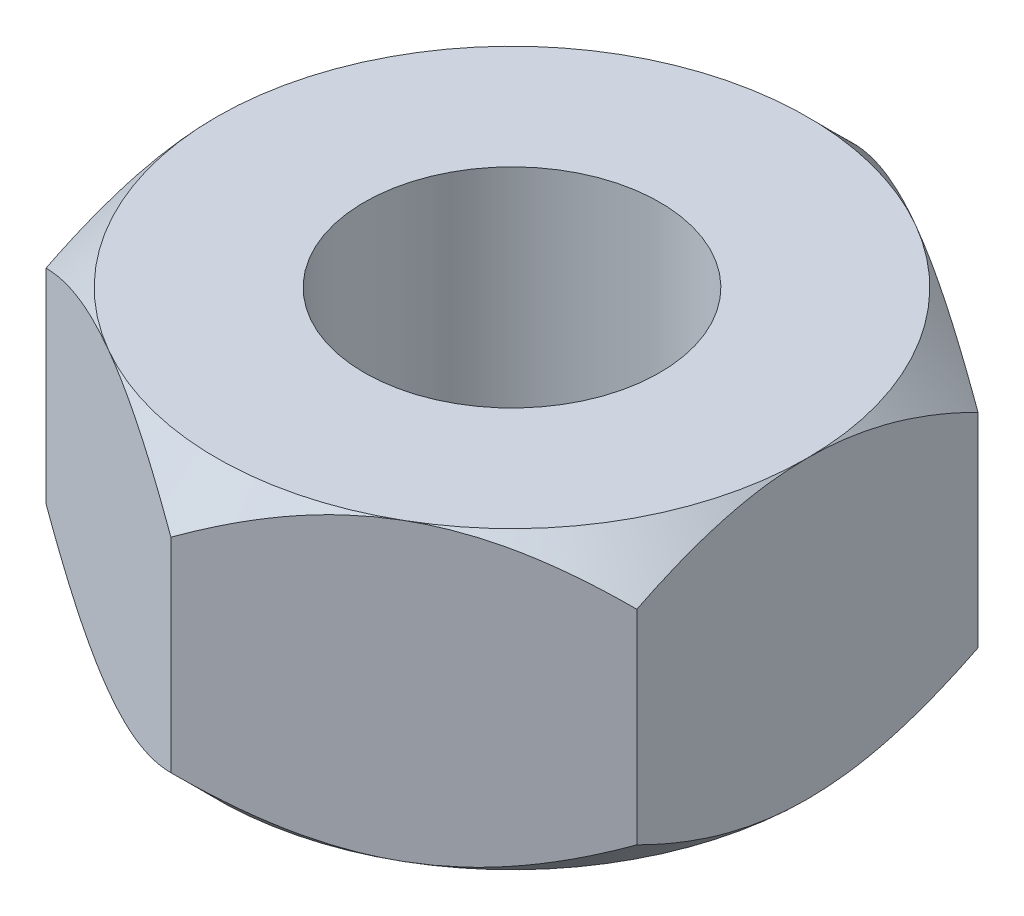
from build123d import *

# Parameters (mm, degrees)
SKETCH1_R           = 1.5
BOSS_EXTRUDE1_DEPTH = 1.5


with BuildPart() as part:
    # Sketch1 → Boss-Extrude1 (new, symmetric)
    with BuildSketch(Plane(origin=(0, 0, 0), x_dir=(1, 0, 0), z_dir=(0, 1, 0))):
        Polygon((0, 3.464101615), (-3, 1.732050808), (-3, -1.732050808), (0, -3.464101615), (3, -1.732050808), (3, 1.732050808), align=None)
        with Locations(Location((0, 0, 0), (0, 0, 270))):
            Circle(SKETCH1_R, mode=Mode.SUBTRACT)
    extrude(amount=BOSS_EXTRUDE1_DEPTH, both=True)

    # Cut-Sweep1: sweep along a path in Sketch2
    with BuildLine(Plane(origin=(0, 1.5, 0), x_dir=(1, 0, 0), z_dir=(0, 1, 0))) as cut_sweep1_path:
        CenterArc((0, 0), 3, 0, 360)
    # Sketch3 → Cut-Sweep1 (sweep, cut)
    with BuildSketch(Plane.XY):
        Polygon((-3.5, 1), (-3, 1.5), (-3.5, 1.5), align=None)
    cut_sweep1 = sweep(path=cut_sweep1_path.line, mode=Mode.SUBTRACT)

    # Mirror1: Cut-Sweep1 across plane
    add(cut_sweep1.mirror(Plane.ZX), mode=Mode.SUBTRACT)


solid = part.part
